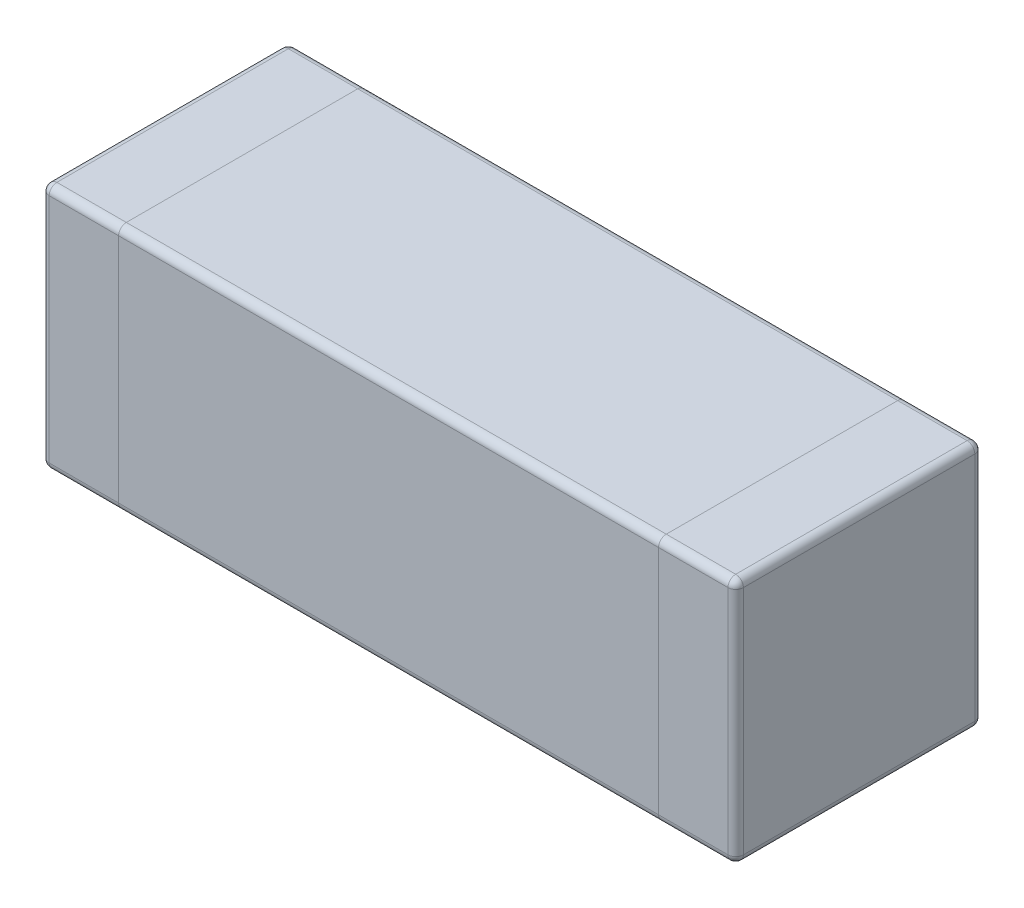
from build123d import *

# Parameters (mm, degrees)
SKETCH1_W      = 4.5
SKETCH1_H      = 1.6
EXTRUDE1_DEPTH = 1.6
FILLET1_R      = 0.05


with BuildPart() as part:
    # Sketch1 → Extrude1 (new body)
    with BuildSketch(Plane(origin=(0, 0, 0), x_dir=(1, 0, 0), z_dir=(0, 1, 0))):
        Rectangle(SKETCH1_W, SKETCH1_H)
    extrude(amount=EXTRUDE1_DEPTH)

    # Fillet1
    fillet1_edges = [part.edges().sort_by_distance(p)[0] for p in [
        (-2.25, 1.6, 0),
        (0, 1.6, 0.8),
        (2.25, 1.6, 0),
        (0, 0, 0.8),
        (-2.25, 0, 0),
        (0, 0, -0.8),
        (2.25, 0, 0),
        (0, 1.6, -0.8),
        (2.25, 0.8, 0.8),
        (-2.25, 0.8, 0.8),
        (-2.25, 0.8, -0.8),
        (2.25, 0.8, -0.8),
    ]]
    fillet(fillet1_edges, radius=FILLET1_R)


solid = part.part
